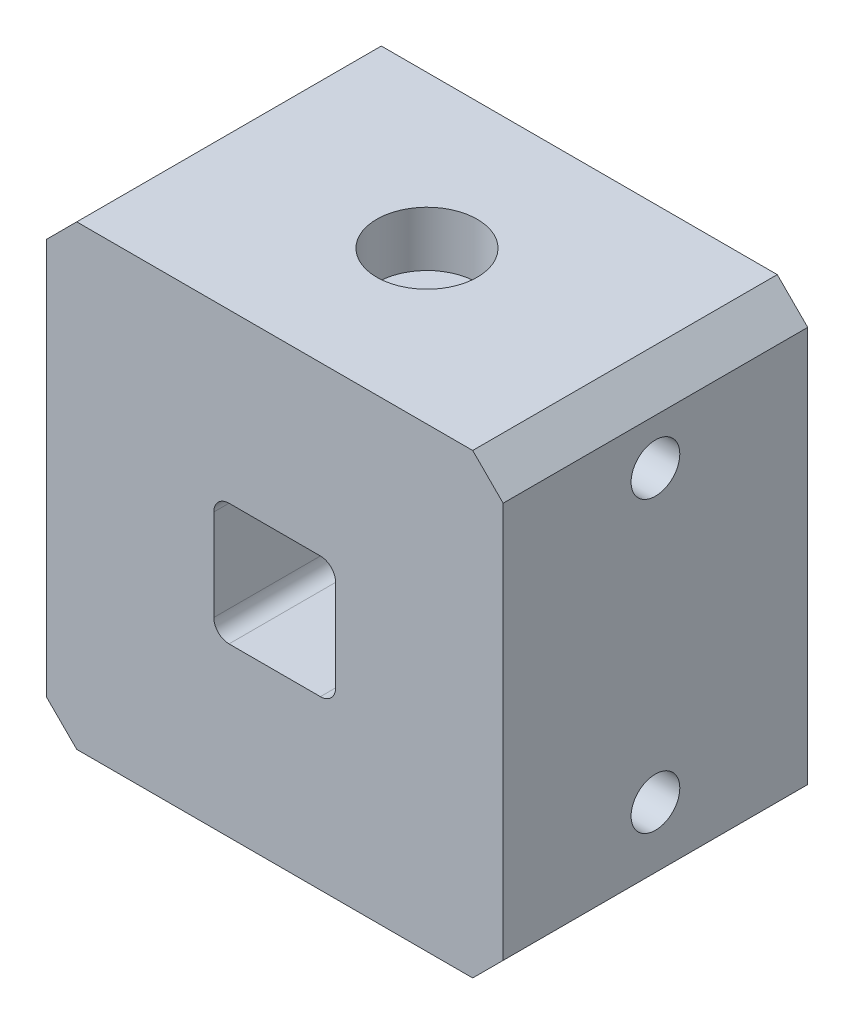
from build123d import *

# Parameters (mm, degrees)
SKETCH1_W                                            = 15
SKETCH1_H                                            = 15
SKETCH1_W_2                                          = 4
SKETCH1_H_2                                          = 4
BOSS_EXTRUDE1_DEPTH                                  = 10
FILLET1_R                                            = 0.5
CBORE_FOR_M1_6_HEXAGON_SOCKET_HEAD_CAP_S_D           = 1.8
CBORE_FOR_M1_6_HEXAGON_SOCKET_HEAD_CAP_S_CBORE_D     = 3.3
CBORE_FOR_M1_6_HEXAGON_SOCKET_HEAD_CAP_S_CBORE_DEPTH = 1.8
M2_TAPPED_HOLE1_AT_2_COUNT                           = 2
M2_TAPPED_HOLE1_AT_2_PITCH                           = 9.5
CHAMFER1_SIZE                                        = 1
CUT_EXTRUDE1_DEPTH                                   = 2
M2_TAPPED_HOLE2_D                                    = 1.6
M2_TAPPED_HOLE2_DEPTH                                = 2
M2_TAPPED_HOLE2_TIP                                  = 0.480688495
SKETCH12_R                                           = 4.5
SKETCH12_R_2                                         = 3
CUT_EXTRUDE2_DEPTH                                   = 2
FILLET2_R                                            = 1
CHAMFER2_SIZE                                        = 1


with BuildPart() as part:
    # Sketch1 → Boss-Extrude1 (new body)
    with BuildSketch(Plane.XY):
        Rectangle(SKETCH1_W, SKETCH1_H)
        Rectangle(SKETCH1_W_2, SKETCH1_H_2, mode=Mode.SUBTRACT)
    extrude(amount=-BOSS_EXTRUDE1_DEPTH)

    # Fillet1
    fillet1_edges = [part.edges().sort_by_distance(p)[0] for p in [
        (2, 2, -5),
        (2, -2, -5),
        (-2, -2, -5),
        (-2, 2, -5),
    ]]
    fillet(fillet1_edges, radius=FILLET1_R)

    # CBORE for M1.6 Hexagon socket head cap screws1 (through all)
    with Locations(Plane(origin=(0, 7.5, 0), x_dir=(1, 0, 0), z_dir=(0, 1, 0))):
        with Locations((0, 5)):
            CounterBoreHole(CBORE_FOR_M1_6_HEXAGON_SOCKET_HEAD_CAP_S_D / 2, CBORE_FOR_M1_6_HEXAGON_SOCKET_HEAD_CAP_S_CBORE_D / 2, CBORE_FOR_M1_6_HEXAGON_SOCKET_HEAD_CAP_S_CBORE_DEPTH)

    # Sketch6 → M2 Tapped Hole1 (revolve, cut)
    with BuildSketch(Plane(origin=(-7.5, 5, -5), x_dir=(0, 0, 1), z_dir=(0, 1, 0))):
        Polygon((0, 0), (0, 5.480688495), (0.8, 5), (0.8, 0), align=None)
    m2_tapped_hole1 = revolve(axis=Axis((-13.85, 5, -5), (1, 0, 0)), mode=Mode.SUBTRACT)

    # M2 Tapped Hole1 at 2: M2 Tapped Hole1 ×2
    with Locations(*[(0, -i * M2_TAPPED_HOLE1_AT_2_PITCH, 0) for i in range(1, M2_TAPPED_HOLE1_AT_2_COUNT)]):
        add(m2_tapped_hole1, mode=Mode.SUBTRACT)

    # Mirror1: M2 Tapped Hole1 across plane
    add(m2_tapped_hole1.mirror(Plane(origin=(0, 0, 0), x_dir=(0, 0, 1), z_dir=(1, 0, 0))), mode=Mode.SUBTRACT)

    # Mirror1 copy 1 sketch → Mirror1 copy 1 (revolve, cut)
    with BuildSketch(Plane(origin=(7.5, -4.5, -5), x_dir=(0, 0, 1), z_dir=(0, 1, 0))):
        Polygon((0, 0), (0, -5.480688495), (0.8, -5), (0.8, 0), align=None)
    revolve(axis=Axis((13.85, -4.5, -5), (1, 0, 0)), mode=Mode.SUBTRACT)

    # Chamfer1
    chamfer1_edges = [part.edges().sort_by_distance(p)[0] for p in [
        (7.5, -7.5, -5),
        (-7.5, -7.5, -5),
    ]]
    chamfer(chamfer1_edges, length=CHAMFER1_SIZE)

    # Sketch8 → Cut-Extrude1 (cut)
    with BuildSketch(Plane(origin=(0, 0, -10), x_dir=(-1, 0, 0), z_dir=(0, 0, -1))):
        with BuildLine():
            ThreePointArc((-5.49078868, 5.818181818), (-5.656854249, 5.656854249), (-5.818181818, 5.49078868))
            ThreePointArc((-5.818181818, 5.49078868), (-5.715871463, 1.956735399), (-2.181818182, 2.059045755))
            ThreePointArc((-2.181818182, 2.059045755), (-2.121320344, 2.121320344), (-2.059045755, 2.181818182))
            ThreePointArc((-2.059045755, 2.181818182), (-1.956735399, 5.715871463), (-5.49078868, 5.818181818))
        make_face()
        with BuildLine():
            ThreePointArc((-5.49078868, -5.818181818), (-5.656854249, -5.656854249), (-5.818181818, -5.49078868))
            ThreePointArc((-5.818181818, -5.49078868), (-5.715871463, -1.956735399), (-2.181818182, -2.059045755))
            ThreePointArc((-2.181818182, -2.059045755), (-2.121320344, -2.121320344), (-2.059045755, -2.181818182))
            ThreePointArc((-2.059045755, -2.181818182), (-1.956735399, -5.715871463), (-5.49078868, -5.818181818))
        make_face()
        with BuildLine():
            ThreePointArc((5.49078868, 5.818181818), (5.656854249, 5.656854249), (5.818181818, 5.49078868))
            ThreePointArc((5.818181818, 5.49078868), (5.715871463, 1.956735399), (2.181818182, 2.059045755))
            ThreePointArc((2.181818182, 2.059045755), (2.121320344, 2.121320344), (2.059045755, 2.181818182))
            ThreePointArc((2.059045755, 2.181818182), (1.956735399, 5.715871463), (5.49078868, 5.818181818))
        make_face()
        with BuildLine():
            ThreePointArc((5.49078868, -5.818181818), (5.656854249, -5.656854249), (5.818181818, -5.49078868))
            ThreePointArc((5.818181818, -5.49078868), (5.715871463, -1.956735399), (2.181818182, -2.059045755))
            ThreePointArc((2.181818182, -2.059045755), (2.121320344, -2.121320344), (2.059045755, -2.181818182))
            ThreePointArc((2.059045755, -2.181818182), (1.956735399, -5.715871463), (5.49078868, -5.818181818))
        make_face()
    extrude(amount=-CUT_EXTRUDE1_DEPTH, mode=Mode.SUBTRACT)

    # M2 Tapped Hole2
    with Locations(Plane(origin=(0, 0, -10), x_dir=(-1, 0, 0), z_dir=(0, 0, -1))):
        with Locations((-6, 0), (0, 6), (6, 0), (0, -6)):
            Hole(M2_TAPPED_HOLE2_D / 2, depth=M2_TAPPED_HOLE2_DEPTH)
            with Locations((0, 0, -(M2_TAPPED_HOLE2_DEPTH + M2_TAPPED_HOLE2_TIP / 2))):  # 118° drill point
                Cone(0, M2_TAPPED_HOLE2_D / 2, M2_TAPPED_HOLE2_TIP, mode=Mode.SUBTRACT)

    # Sketch12 → Cut-Extrude2 (cut)
    with BuildSketch(Plane(origin=(0, 0, -10), x_dir=(-1, 0, 0), z_dir=(0, 0, -1))):
        Circle(SKETCH12_R)
        with Locations(Location((0, 0, 0), (0, 0, 180))):
            Circle(SKETCH12_R_2, mode=Mode.SUBTRACT)
    extrude(amount=-CUT_EXTRUDE2_DEPTH, mode=Mode.SUBTRACT)

    # Fillet2
    fillet2_edges = [part.edges().sort_by_distance(p)[0] for p in [
        (1.294196531, 4.309878808, -9),
        (-1.294196531, 4.309878808, -9),
        (4.309878808, 1.294196531, -9),
        (4.309878808, -1.294196531, -9),
        (-1.294196531, -4.309878808, -9),
        (1.294196531, -4.309878808, -9),
        (-4.309878808, -1.294196531, -9),
        (-4.309878808, 1.294196531, -9),
    ]]
    fillet(fillet2_edges, radius=FILLET2_R)

    # Chamfer2
    chamfer2_edges = [part.edges().sort_by_distance(p)[0] for p in [
        (-7.5, 7.5, -5),
        (7.5, 7.5, -5),
    ]]
    chamfer(chamfer2_edges, length=CHAMFER2_SIZE)


solid = part.part
